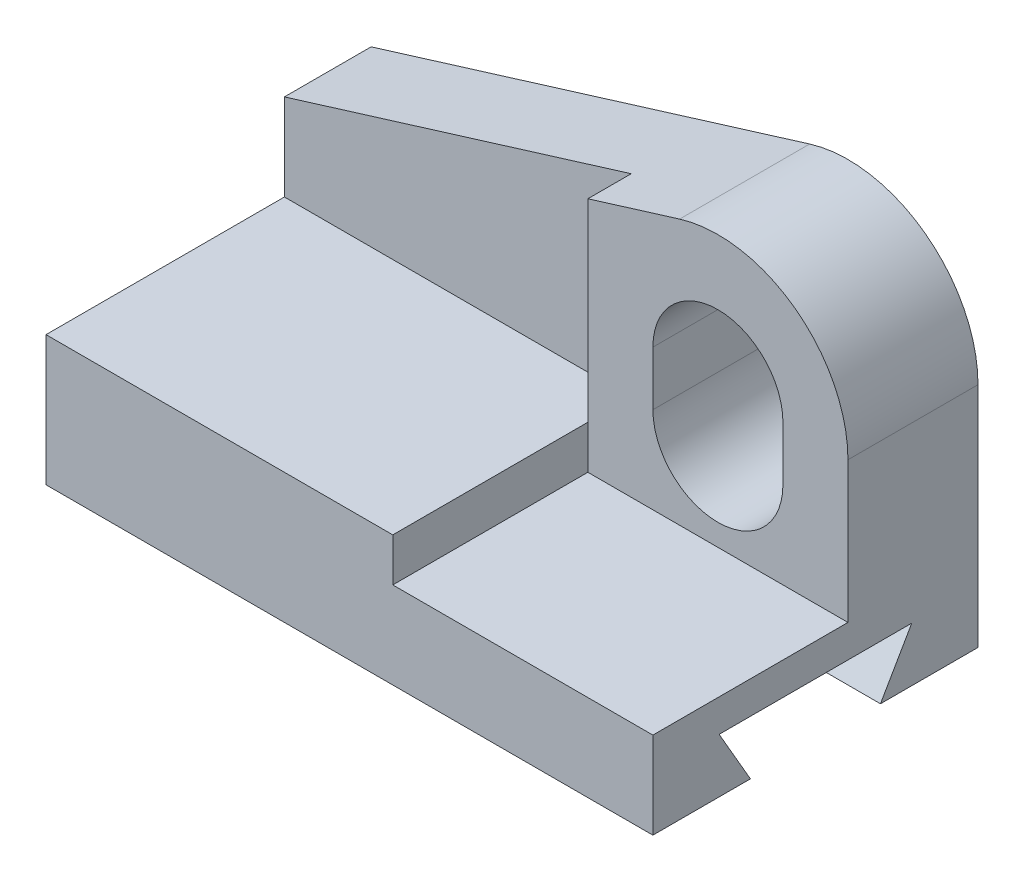
from build123d import *

# Parameters (mm, degrees)
SKETCH_1_W          = 56
SKETCH_1_H          = 30
EXTRUDE_1_DEPTH     = 12
CUT_EXTRUDE_1_DEPTH = 60.203040462
SKETCH_3_W          = 24
SKETCH_3_H          = 4
CUT_EXTRUDE_2_DEPTH = 43.755116653
EXTRUDE_2_DEPTH     = 8
EXTRUDE_3_DEPTH     = 4


with BuildPart() as part:
    # 草图1 → 凸台-拉伸1 (new body)
    with BuildSketch(Plane(origin=(0, 0, 0), x_dir=(1, 0, 0), z_dir=(0, 1, 0))):
        Rectangle(SKETCH_1_W, SKETCH_1_H)
    extrude(amount=EXTRUDE_1_DEPTH)

    # 草图2 → 切除-拉伸1 (cut, through all)
    with BuildSketch(Plane.ZY.offset(28)):
        Polygon((-6, 0), (-8.886751346, 5), (8.886751346, 5), (6, 0), align=None)
    extrude(amount=-CUT_EXTRUDE_1_DEPTH, mode=Mode.SUBTRACT)

    # 草图3 → 切除-拉伸2 (cut, through all)
    with BuildSketch(Plane.XY.offset(15)):
        with Locations((16, 10)):
            Rectangle(SKETCH_3_W, SKETCH_3_H)
    extrude(amount=-CUT_EXTRUDE_2_DEPTH, mode=Mode.SUBTRACT)

    # 草图4 → 凸台-拉伸2 (add)
    # profile 1 of 2: a face of its own
    with BuildSketch(Plane(origin=(0, 0, -15), x_dir=(-1, 0, 0), z_dir=(0, 0, -1))):
        with BuildLine():
            ThreePointArc((-12.466636051, 32.468013743), (-6.345975777, 28.127398986), (-4, 21))
            Line((-4, 21), (-4, 12))
            Line((-4, 12), (28, 12))
            Line((28, 12), (28, 20))
            Line((28, 20), (-12.466636051, 32.468013743))
        make_face()
    # profile 2 of 2: a face of its own
    with BuildSketch(Plane(origin=(0, 0, -15), x_dir=(-1, 0, 0), z_dir=(0, 0, -1))):
        with BuildLine():
            Line((-4, 12), (-4, 21))
            ThreePointArc((-4, 21), (-6.345975777, 28.127398986), (-12.466636051, 32.468013743))
            ThreePointArc((-12.466636051, 32.468013743), (-23.127398986, 30.654024223), (-28, 21))
            Line((-28, 21), (-28, 8))
            Line((-28, 8), (-4, 8))
            Line((-4, 8), (-4, 12))
        make_face()
        with BuildLine():
            ThreePointArc((-10, 16), (-16, 10), (-22, 16))
            Line((-22, 16), (-22, 21))
            ThreePointArc((-22, 21), (-16, 27), (-10, 21))
            Line((-10, 21), (-10, 16))
        make_face(mode=Mode.SUBTRACT)
    extrude(amount=-EXTRUDE_2_DEPTH)

    # 草图5 → 凸台-拉伸3 (add)
    with BuildSketch(Plane.XY.offset(-7)):
        with BuildLine():
            Line((28, 8), (28, 21))
            ThreePointArc((28, 21), (23.127398986, 30.654024223), (12.466636051, 32.468013743))
            Line((12.466636051, 32.468013743), (4, 29.859392297))
            Line((4, 29.859392297), (4, 12))
            Line((4, 12), (4, 8))
            Line((4, 8), (28, 8))
        make_face()
        with BuildLine():
            Line((22, 21), (22, 16))
            ThreePointArc((22, 16), (16, 10), (10, 16))
            Line((10, 16), (10, 21))
            ThreePointArc((10, 21), (16, 27), (22, 21))
        make_face(mode=Mode.SUBTRACT)
    extrude(amount=EXTRUDE_3_DEPTH)


solid = part.part
